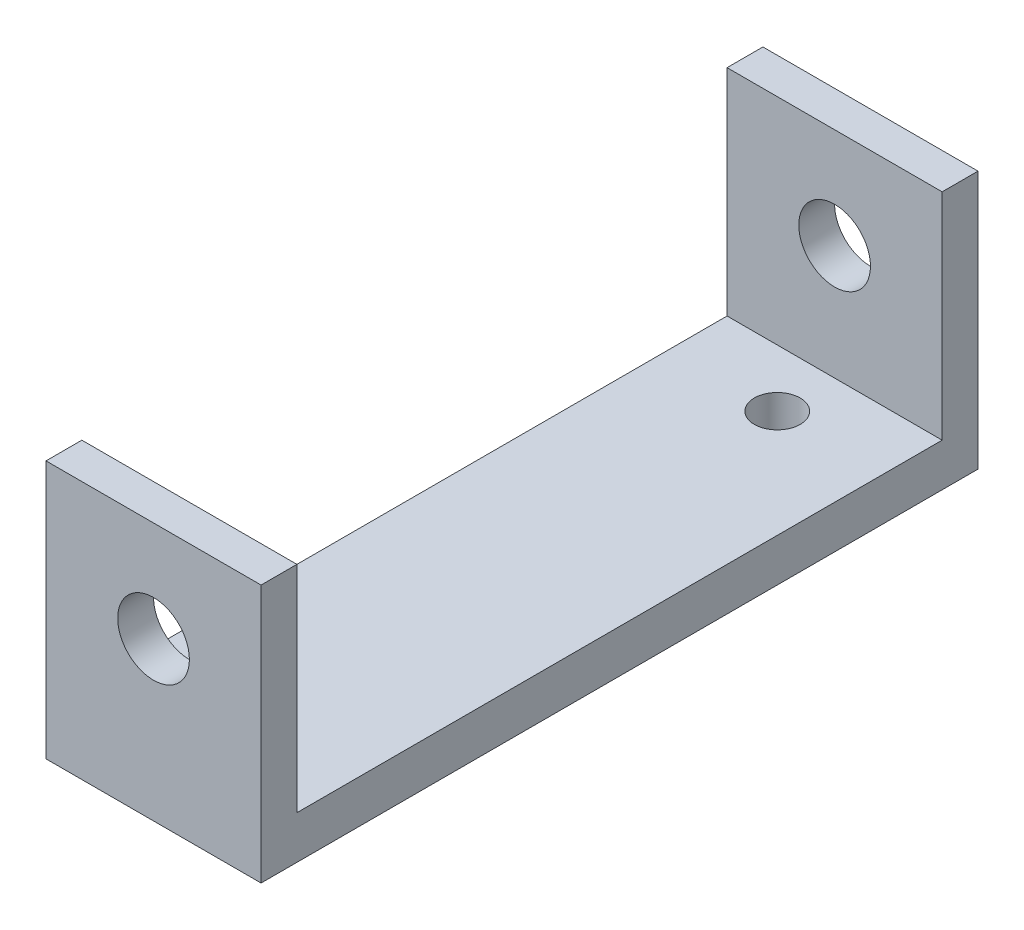
from build123d import *

# Parameters (mm, degrees)
ESQUISSE1_W             = 15
ESQUISSE1_H             = 3
BOSS_EXTRU_1_DEPTH      = 50
ESQUISSE2_R             = 1.6
ENL_V_MAT_EXTRU_1_DEPTH = 45
ESQUISSE3_W             = 15
ESQUISSE3_H             = 2.5
BOSS_EXTRU_2_DEPTH      = 15
ESQUISSE4_R             = 2.5
ENL_V_MAT_EXTRU_3_DEPTH = 65


with BuildPart() as part:
    # Esquisse1 → Boss.-Extru.1 (new body)
    with BuildSketch(Plane.XY):
        with Locations((-116.877940306, 30.735985997)):
            Rectangle(ESQUISSE1_W, ESQUISSE1_H)
    extrude(amount=BOSS_EXTRU_1_DEPTH)

    # Esquisse2 → Enlèv. mat.-Extru.1 (cut)
    with BuildSketch(Plane(origin=(0, 32.235985997, 0), x_dir=(1, 0, 0), z_dir=(0, 1, 0))):
        with Locations(Location((-116.877940306, -43.5, 0), (0, 0, 270))):
            Circle(ESQUISSE2_R)
        with Locations(Location((-116.877940306, -6.5, 0), (0, 0, 270))):
            Circle(ESQUISSE2_R)
    extrude(amount=-ENL_V_MAT_EXTRU_1_DEPTH, mode=Mode.SUBTRACT)

    # Esquisse3 → Boss.-Extru.2 (add)
    with BuildSketch(Plane(origin=(0, 32.235985997, 0), x_dir=(1, 0, 0), z_dir=(0, 1, 0))):
        with Locations((-116.877940306, -48.75)):
            Rectangle(ESQUISSE3_W, ESQUISSE3_H)
        with Locations((-116.877940306, -1.25)):
            Rectangle(ESQUISSE3_W, ESQUISSE3_H)
    extrude(amount=BOSS_EXTRU_2_DEPTH)

    # Esquisse4 → Enlèv. mat.-Extru.3 (cut)
    with BuildSketch(Plane.XY.offset(50)):
        with Locations((-116.877940306, 40.235985997)):
            Circle(ESQUISSE4_R)
    extrude(amount=-ENL_V_MAT_EXTRU_3_DEPTH, mode=Mode.SUBTRACT)


solid = part.part
